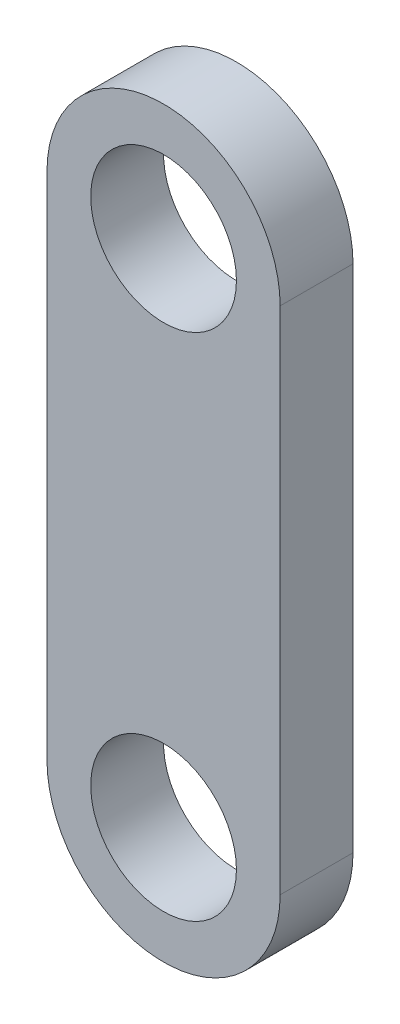
from build123d import *

# Parameters (mm, degrees)
SKETCH_1_R      = 0.5
EXTRUDE_1_DEPTH = 0.5


with BuildPart() as part:
    # 草圖1 → 填料-伸長1 (new body)
    with BuildSketch(Plane.XY):
        with BuildLine():
            Line((-0.8, -1.75), (-0.8, 1.75))
            ThreePointArc((-0.8, 1.75), (0, 2.55), (0.8, 1.75))
            Line((0.8, 1.75), (0.8, -1.75))
            ThreePointArc((0.8, -1.75), (0, -2.55), (-0.8, -1.75))
        make_face()
        with Locations((0, 1.75)):
            Circle(SKETCH_1_R, mode=Mode.SUBTRACT)
        with Locations((0, -1.75)):
            Circle(SKETCH_1_R, mode=Mode.SUBTRACT)
    extrude(amount=EXTRUDE_1_DEPTH)


solid = part.part
